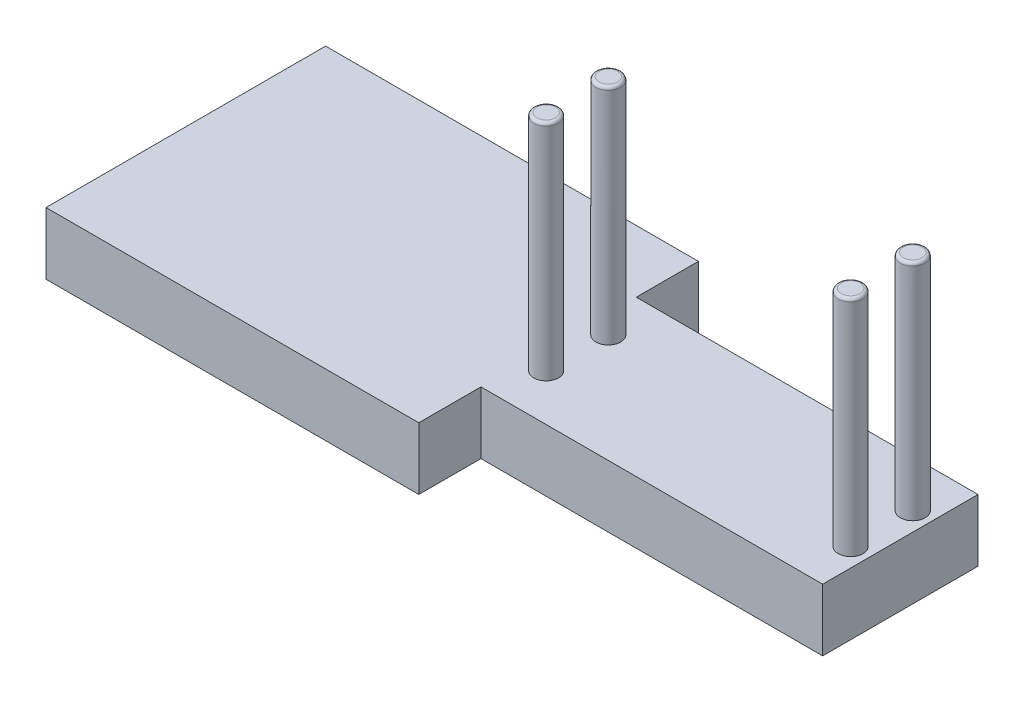
from build123d import *

# Parameters (mm, degrees)
BOSS_EXTRUDE2_DEPTH = 10
SKETCH6_R           = 2
BOSS_EXTRUDE3_DEPTH = 36
FILLET2_R           = 0.5


with BuildPart() as part:
    # Sketch1 → Boss-Extrude2 (new body)
    with BuildSketch(Plane(origin=(0, 0, 0), x_dir=(1, 0, 0), z_dir=(0, 1, 0))):
        Polygon((30, -12.5), (30, -22.5), (-30, -22.5), (-30, 22.5), (30, 22.5), (30, 12.5), (85, 12.5), (85, -12.5), align=None)
    extrude(amount=BOSS_EXTRUDE2_DEPTH)

    # Sketch6 → Boss-Extrude3 (add)
    with BuildSketch(Plane(origin=(0, 10, 0), x_dir=(1, 0, 0), z_dir=(0, 1, 0))):
        with Locations(Location((33, 5, 0), (0, 0, 90))):
            Circle(SKETCH6_R)
        with Locations(Location((33, -5, 0), (0, 0, 90))):
            Circle(SKETCH6_R)
        with Locations(Location((82, 5, 0), (0, 0, 90))):
            Circle(SKETCH6_R)
        with Locations(Location((82, -5, 0), (0, 0, 90))):
            Circle(SKETCH6_R)
    extrude(amount=BOSS_EXTRUDE3_DEPTH)

    # Fillet2
    fillet2_edges = [part.edges().sort_by_distance(p)[0] for p in [
        (82, 46, -3),
        (33, 46, 7),
        (33, 46, -3),
        (82, 46, 7),
    ]]
    fillet(fillet2_edges, radius=FILLET2_R)


solid = part.part
